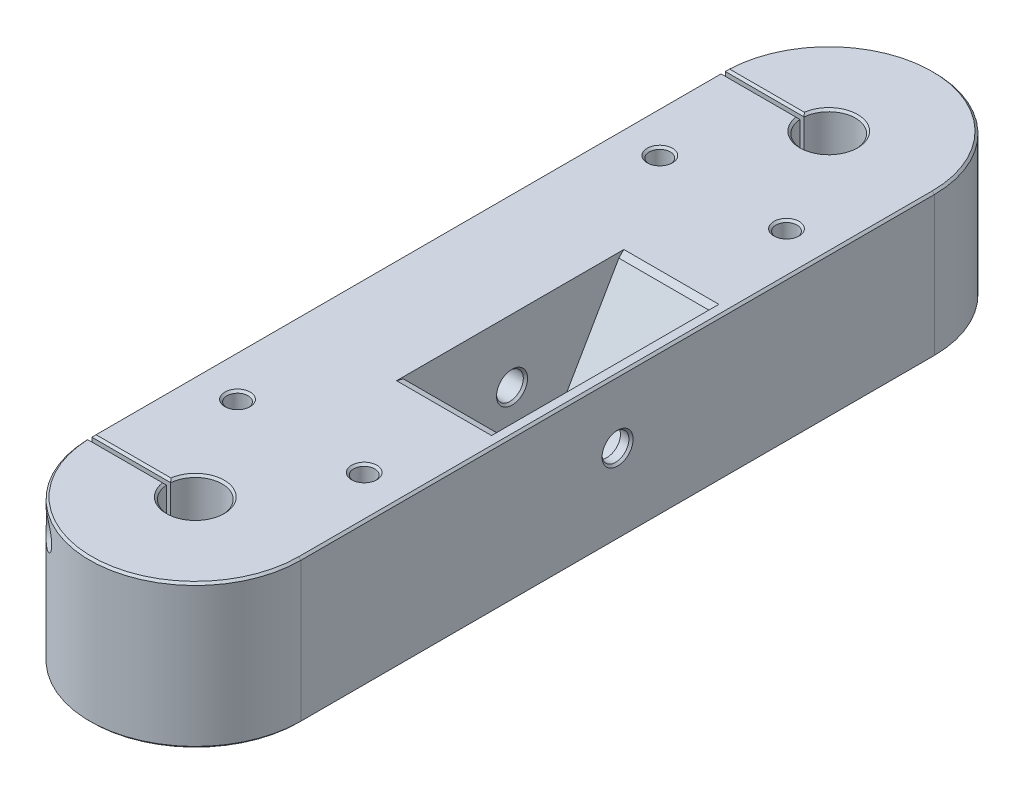
from build123d import *
from OCP.BRepFilletAPI import BRepFilletAPI_MakeChamfer

# Parameters (mm, degrees)
BOSS_EXTRUDE1_DEPTH      = 10
BOSS_EXTRUDE1_DEPTH_BACK = 24.004
SKETCH1_R                = 2.5
CUT_EXTRUDE1_START       = -80
SKETCH2_R                = 3.5
SKETCH2_R_2              = 1.75
SKETCH2_R_3              = 1.25
CUT_EXTRUDE1_DEPTH       = 26.835684039
CUT_EXTRUDE2_START       = -75.5
SKETCH2_6_R              = 1.75
SKETCH2_6_R_2            = 1.25
CUT_EXTRUDE2_DEPTH       = 31.33568418
CUT_EXTRUDE3_START       = -74.5
SKETCH2_7_R              = 1.25
CUT_EXTRUDE3_DEPTH       = 15
SKETCH3_W                = 57.958934366
SKETCH3_H                = 38.963082507
CUT_EXTRUDE4_DEPTH       = 106.83568418
CUT_EXTRUDE5_START       = -25
SKETCH4_R                = 3.175
CUT_EXTRUDE5_DEPTH       = 22.5
SKETCH4_2_R              = 3.175
CUT_EXTRUDE6_DEPTH       = 115.351178616
CHAMFER1_SIZE            = 0.5
CHAMFER1_SIZE2           = 1.366025404


with BuildPart() as part:
    # Sketch1 → Boss-Extrude1 (new, two sides: drawn at the far end of the back side and taken through both)
    with BuildSketch(Plane(origin=(0, 0, 0), x_dir=(1, 0, 0), z_dir=(0, 1, 0)).offset(-BOSS_EXTRUDE1_DEPTH_BACK)):
        with BuildLine():
            Line((-25, 74.5), (-25, -74.5))
            Line((-25, -74.5), (-6.330284354, -74.5))
            ThreePointArc((-6.330284354, -74.5), (0, -68.65), (6.330284354, -74.5))
            ThreePointArc((6.330284354, -74.5), (6.345069174, -74.749805722), (6.35, -75))
            ThreePointArc((6.35, -75), (6.345069174, -75.250194278), (6.330284354, -75.5))
            ThreePointArc((6.330284354, -75.5), (0, -81.35), (-6.330284354, -75.5))
            Line((-6.330284354, -75.5), (-24.9949995, -75.5))
            ThreePointArc((-24.9949995, -75.5), (0, -100), (24.9949995, -75.5))
            ThreePointArc((24.9949995, -75.5), (24.998749844, -75.250012502), (25, -75))
            Line((25, -75), (25, 75))
            ThreePointArc((25, 75), (24.998749844, 75.250012502), (24.9949995, 75.5))
            ThreePointArc((24.9949995, 75.5), (0, 100), (-24.9949995, 75.5))
            Line((-24.9949995, 75.5), (-6.330284354, 75.5))
            ThreePointArc((-6.330284354, 75.5), (0, 81.35), (6.330284354, 75.5))
            ThreePointArc((6.330284354, 75.5), (6.345069174, 75.250194278), (6.35, 75))
            ThreePointArc((6.35, 75), (6.345069174, 74.749805722), (6.330284354, 74.5))
            ThreePointArc((6.330284354, 74.5), (0, 68.65), (-6.330284354, 74.5))
            Line((-6.330284354, 74.5), (-25, 74.5))
        make_face()
        with Locations(Location((-15, -50, 0), (0, 0, 270))):
            Circle(SKETCH1_R, mode=Mode.SUBTRACT)
        with Locations(Location((15, -50, 0), (0, 0, 270))):
            Circle(SKETCH1_R, mode=Mode.SUBTRACT)
        with Locations(Location((-15, 50, 0), (0, 0, 270))):
            Circle(SKETCH1_R, mode=Mode.SUBTRACT)
        with Locations(Location((15, 50, 0), (0, 0, 270))):
            Circle(SKETCH1_R, mode=Mode.SUBTRACT)
    extrude(amount=BOSS_EXTRUDE1_DEPTH + BOSS_EXTRUDE1_DEPTH_BACK)

    # Sketch2 → Cut-Extrude1 (cut, through all)
    # profile 1 of 3: a face of its own
    with BuildSketch(Plane.XY.offset(CUT_EXTRUDE1_START)):
        with Locations((-15.67249975, 5)):
            Circle(SKETCH2_R)
        with Locations((-15.67249975, 5)):
            Circle(SKETCH2_R_2, mode=Mode.SUBTRACT)
    # profile 2 of 3: a face of its own
    with BuildSketch(Plane.XY.offset(CUT_EXTRUDE1_START)):
        with Locations((-15.67249975, 5)):
            Circle(SKETCH2_R_2)
        with Locations((-15.67249975, 5)):
            Circle(SKETCH2_R_3, mode=Mode.SUBTRACT)
    # profile 3 of 3: a face of its own
    with BuildSketch(Plane.XY.offset(CUT_EXTRUDE1_START)):
        with Locations((-15.67249975, 5)):
            Circle(SKETCH2_R_3)
    extrude(amount=-CUT_EXTRUDE1_DEPTH, mode=Mode.SUBTRACT)

    # Sketch2<6> → Cut-Extrude2 (cut, through all)
    # profile 1 of 2: a face of its own
    with BuildSketch(Plane.XY.offset(CUT_EXTRUDE2_START)):
        with Locations((-15.67249975, 5)):
            Circle(SKETCH2_6_R)
        with Locations((-15.67249975, 5)):
            Circle(SKETCH2_6_R_2, mode=Mode.SUBTRACT)
    # profile 2 of 2: a face of its own
    with BuildSketch(Plane.XY.offset(CUT_EXTRUDE2_START)):
        with Locations((-15.67249975, 5)):
            Circle(SKETCH2_6_R_2)
    extrude(amount=-CUT_EXTRUDE2_DEPTH, mode=Mode.SUBTRACT)

    # Sketch2<7> → Cut-Extrude3 (cut)
    with BuildSketch(Plane.XY.offset(CUT_EXTRUDE3_START)):
        with Locations((-15.67249975, 5)):
            Circle(SKETCH2_7_R)
    extrude(amount=CUT_EXTRUDE3_DEPTH, mode=Mode.SUBTRACT)

    # Sketch3 → Cut-Extrude4 (cut, through all)
    with BuildSketch(Plane.XY):
        with Locations((1.618964647, -7.082948233)):
            Rectangle(SKETCH3_W, SKETCH3_H)
    extrude(amount=CUT_EXTRUDE4_DEPTH, mode=Mode.SUBTRACT)

    # Mirror1: part across plane


with BuildPart() as part_1:
    add(part.part)
    add(part.part.mirror(Plane.XY))

    # Sketch4 → Cut-Extrude5 (cut)
    with BuildSketch(Plane.ZY.offset(25).offset(CUT_EXTRUDE5_START)):
        with BuildLine():
            Line((-25.980762114, 10), (25.980762114, 10))
            Line((25.980762114, 10), (12.990381057, -12.5))
            ThreePointArc((12.990381057, -12.5), (0, -20), (-12.990381057, -12.5))
            Line((-12.990381057, -12.5), (-25.980762114, 10))
        make_face()
        with Locations((0, -5)):
            Circle(SKETCH4_R, mode=Mode.SUBTRACT)
    extrude(amount=-CUT_EXTRUDE5_DEPTH, mode=Mode.SUBTRACT)

    # Sketch4<2> → Cut-Extrude6 (cut, through all)
    with BuildSketch(Plane.ZY.offset(25)):
        with Locations((0, -5)):
            Circle(SKETCH4_2_R)
    extrude(amount=-CUT_EXTRUDE6_DEPTH, mode=Mode.SUBTRACT)

    # Chamfer1: one chamfer whose edges measure the first distance from different faces: ONE call of the kernel's chamfer builder (chamfer() names one face for all edges)
    chamfer1_edges_1 = [part_1.edges().sort_by_distance(p)[0] for p in [
        (15, -24.004, -52.5),
        (0.250012502, -24.004, 99.998749844),
        (-15.662641927, -24.004, 75.5),
        (-15, 10, 52.5),
        (15, 10, 52.5),
        (-15.665142177, 10, 74.5),
        (0.5, 10, 81.330284354),
        (-15.665142177, -24.004, 74.5),
        (0.5, -24.004, 81.330284354),
        (-17.42249975, 5, 75.5),
        (-15.662641927, 10, 75.5),
        (-15, -24.004, 52.5),
        (15, -24.004, 52.5),
        (0.250012502, 10, 99.998749844),
        (-17.42249975, 5, 80),
        (-16.92249975, 5, 74.5),
        (0, -5, -3.175),
        (25, -7.24506403, 2.24506403),
        (-25, -2.75493597, 2.24506403),
        (-15, -24.004, -52.5),
        (0.250012502, -24.004, -99.998749844),
        (0.5, 10, -81.330284354),
        (-15.665142177, 10, -74.5),
        (-15.662641927, -24.004, -75.5),
        (-15, 10, -52.5),
        (15, 10, -52.5),
        (0.250012502, 10, -99.998749844),
        (-15.662641927, 10, -75.5),
        (0.5, -24.004, -81.330284354),
        (-15.665142177, -24.004, -74.5),
        (-17.42249975, 5, -80),
        (-17.42249975, 5, -75.5),
        (-16.92249975, 5, -74.5),
        (-16.92249975, 5, -59.5),
        (25, 10, -37.5),
        (-25, 10, -37.25),
        (25, -24.004, 37.5),
        (-25, -24.004, -37.25),
    ]]
    chamfer1_edges_2 = [part_1.edges().sort_by_distance(p)[0] for p in [
        (11.25, 10, -25.980762114),
    ]]
    chamfer1_side_2 = [part_1.faces().sort_by_distance(p)[0] for p in [
        (-1.58584153, 10, 0),
    ]]
    chamfer1_edges_3 = [part_1.edges().sort_by_distance(p)[0] for p in [
        (11.25, 10, 25.980762114),
    ]]
    chamfer1_side_3 = [part_1.faces().sort_by_distance(p)[0] for p in [
        (11.25, -1.25, 19.485571585),
    ]]
    chamfer1 = BRepFilletAPI_MakeChamfer(part_1.part.solid().wrapped)
    for e in chamfer1_edges_1:
        chamfer1.Add(CHAMFER1_SIZE, e.wrapped)
    for e in chamfer1_edges_2:
        chamfer1.Add(CHAMFER1_SIZE, CHAMFER1_SIZE2, e.wrapped, chamfer1_side_2[0].wrapped)  # the first distance lies on this face
    for e in chamfer1_edges_3:
        chamfer1.Add(CHAMFER1_SIZE, CHAMFER1_SIZE2, e.wrapped, chamfer1_side_3[0].wrapped)  # the first distance lies on this face
    add(Compound.cast(chamfer1.Shape()), mode=Mode.REPLACE)


solid = part_1.part
